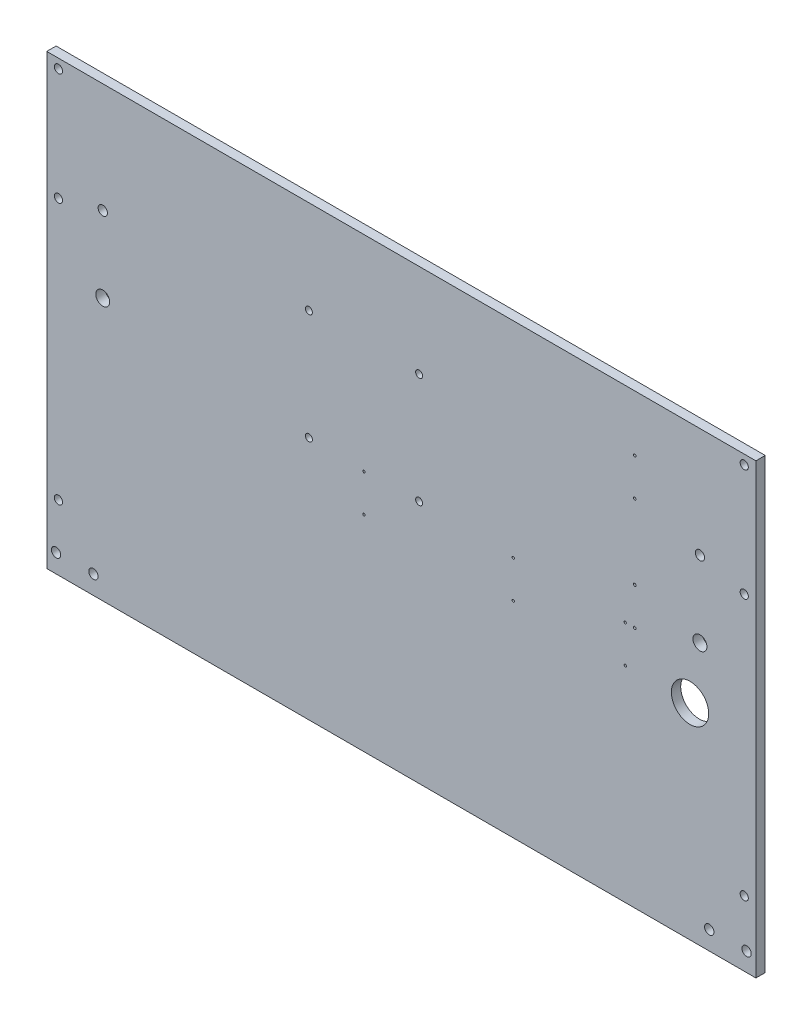
from build123d import *

# Parameters (mm, degrees)
SKETCH1_W           = 482.6
SKETCH1_H           = 304.8
BOSS_EXTRUDE1_DEPTH = 6.35
SKETCH2_R           = 2.7813
CUT_EXTRUDE1_DEPTH  = 286.467638271
SKETCH3_R           = 3.175
CUT_EXTRUDE2_DEPTH  = 286.467638271
SKETCH4_R           = 12.7
CUT_EXTRUDE3_DEPTH  = 286.467638271
SKETCH5_R           = 2.3749
CUT_EXTRUDE4_DEPTH  = 286.467638271
SKETCH6_R           = 3.175
SKETCH6_R_2         = 4.7625
CUT_EXTRUDE5_DEPTH  = 286.467638271
SKETCH7_R           = 0.889
CUT_EXTRUDE6_DEPTH  = 286.467638271
SKETCH8_R           = 0.8255
SKETCH8_R_2         = 0.79375
CUT_EXTRUDE7_DEPTH  = 286.467638271


with BuildPart() as part:
    # Sketch1 → Boss-Extrude1 (new body)
    with BuildSketch(Plane.XY):
        Rectangle(SKETCH1_W, SKETCH1_H)
    extrude(amount=BOSS_EXTRUDE1_DEPTH)

    # Sketch2 → Cut-Extrude1 (cut, through all)
    with BuildSketch(Plane.XY.offset(6.35)):
        with Locations((-233.3498, 146.05)):
            Circle(SKETCH2_R)
        with Locations((-233.3498, -107.95)):
            Circle(SKETCH2_R)
        with Locations((-233.3498, 69.85)):
            Circle(SKETCH2_R)
    cut_extrude1 = extrude(amount=-CUT_EXTRUDE1_DEPTH, mode=Mode.SUBTRACT)

    # Mirror1: Cut-Extrude1 across plane
    add(cut_extrude1.mirror(Plane(origin=(0, 0, 0), x_dir=(0, 0, 1), z_dir=(1, 0, 0))), mode=Mode.SUBTRACT)

    # Sketch3 → Cut-Extrude2 (cut, through all)
    with BuildSketch(Plane.XY.offset(6.35)):
        with Locations((-234.95, -139.7)):
            Circle(SKETCH3_R)
        with Locations((-209.55, -139.7)):
            Circle(SKETCH3_R)
    cut_extrude2 = extrude(amount=-CUT_EXTRUDE2_DEPTH, mode=Mode.SUBTRACT)

    # Mirror2: Cut-Extrude2 across plane
    add(cut_extrude2.mirror(Plane(origin=(0, 0, 0), x_dir=(0, 0, 1), z_dir=(1, 0, 0))), mode=Mode.SUBTRACT)

    # Sketch4 → Cut-Extrude3 (cut, through all)
    with BuildSketch(Plane.XY.offset(6.35)):
        with Locations((196.469, -12.7)):
            Circle(SKETCH4_R)
    extrude(amount=-CUT_EXTRUDE3_DEPTH, mode=Mode.SUBTRACT)

    # Sketch5 → Cut-Extrude4 (cut, through all)
    with BuildSketch(Plane.XY.offset(6.35)):
        with Locations((-62.9, 88.9)):
            Circle(SKETCH5_R)
        with Locations((12.1, 88.9)):
            Circle(SKETCH5_R)
        with Locations((12.1, 13.9)):
            Circle(SKETCH5_R)
        with Locations((-62.9, 13.9)):
            Circle(SKETCH5_R)
    extrude(amount=-CUT_EXTRUDE4_DEPTH, mode=Mode.SUBTRACT)

    # Sketch6 → Cut-Extrude5 (cut, through all)
    with BuildSketch(Plane.XY.offset(6.35)):
        with Locations((-203.2, 77.727111167)):
            Circle(SKETCH6_R)
        with Locations((-203.2, 26.096105915)):
            Circle(SKETCH6_R_2)
        with Locations((203.2, 77.727111167)):
            Circle(SKETCH6_R)
        with Locations((203.2, 26.096105915)):
            Circle(SKETCH6_R_2)
    extrude(amount=-CUT_EXTRUDE5_DEPTH, mode=Mode.SUBTRACT)

    # Sketch7 → Cut-Extrude6 (cut, through all)
    with BuildSketch(Plane.XY.offset(6.35)):
        with Locations((158.821461806, 114.3)):
            Circle(SKETCH7_R)
        with Locations((158.821461806, 88.9)):
            Circle(SKETCH7_R)
        with Locations((158.821461806, 38.1)):
            Circle(SKETCH7_R)
        with Locations((158.821461806, 12.7)):
            Circle(SKETCH7_R)
    extrude(amount=-CUT_EXTRUDE6_DEPTH, mode=Mode.SUBTRACT)

    # Sketch8 → Cut-Extrude7 (cut, through all)
    with BuildSketch(Plane.XY.offset(6.35)):
        with Locations((-25.4, 12.7)):
            Circle(SKETCH8_R)
        with Locations((-25.4, -12.7)):
            Circle(SKETCH8_R)
        with Locations((76.2, 12.7)):
            Circle(SKETCH8_R_2)
        with Locations((76.2, -12.7)):
            Circle(SKETCH8_R_2)
        with Locations((152.4, 12.7)):
            Circle(SKETCH8_R_2)
        with Locations((152.4, -12.7)):
            Circle(SKETCH8_R_2)
    extrude(amount=-CUT_EXTRUDE7_DEPTH, mode=Mode.SUBTRACT)


solid = part.part
